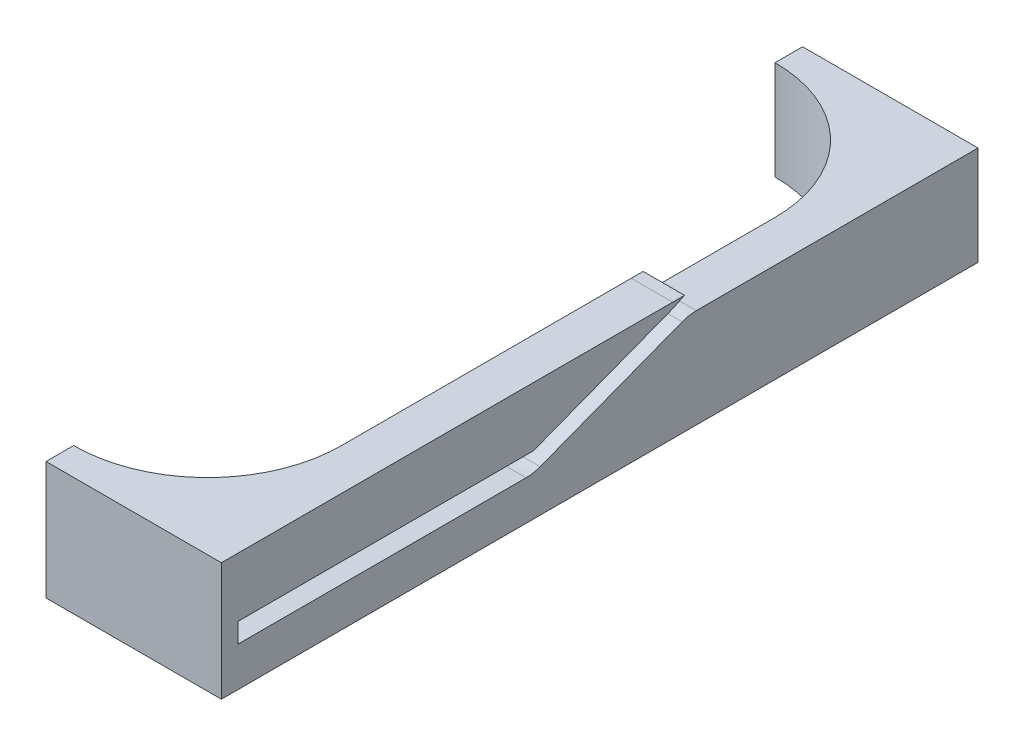
from build123d import *

# Parameters (mm, degrees)
SKETCH1_W           = 89
SKETCH1_H           = 192
BOSS_EXTRUDE1_DEPTH = 30
SKETCH2_R           = 34.99943994
CUT_EXTRUDE1_DEPTH  = 10
SKETCH3_W           = 75
SKETCH3_H           = 5
CUT_EXTRUDE2_DEPTH  = 102
CUT_EXTRUDE4_DEPTH  = 102
SKETCH6_W           = 10.5
SKETCH6_H           = 4
CUT_EXTRUDE7_DEPTH  = 8
BOSS_EXTRUDE2_DEPTH = 10.5
CUT_EXTRUDE8_DEPTH  = 20.767757578
BOSS_EXTRUDE3_DEPTH = 10.5
CUT_EXTRUDE9_DEPTH  = 22.812544275
BOSS_EXTRUDE6_DEPTH = 10.5
BOSS_EXTRUDE7_DEPTH = 10.5
FILLET1_R           = 10
FILLET2_R           = 10
FILLET3_R           = 10
FILLET4_R           = 10
CUT_EXTRUDE11_DEPTH = 99
SKETCH15_W          = 7.554212703
SKETCH15_H          = 3.259234926
CUT_EXTRUDE12_DEPTH = 99
FILLET5_R           = 10
SKETCH16_W          = 51.485854904
SKETCH16_H          = 41.780762453
CUT_EXTRUDE13_DEPTH = 221


with BuildPart() as part:
    # Sketch1 → Boss-Extrude1 (new body)
    with BuildSketch(Plane(origin=(0, 0, 0), x_dir=(1, 0, 0), z_dir=(0, 1, 0))):
        with Locations((-10.5, 20.043668932)):
            Rectangle(SKETCH1_W, SKETCH1_H)
        with BuildLine():
            Line((-44.5, -34.956331068), (-44.5, 75.043668932))
            ThreePointArc((-44.5, 75.043668932), (-10.5, 109.043668932), (23.5, 75.043668932))
            Line((23.5, 75.043668932), (23.5, -34.956331068))
            ThreePointArc((23.5, -34.956331068), (-10.5, -68.956331068), (-44.5, -34.956331068))
        make_face(mode=Mode.SUBTRACT)
    extrude(amount=BOSS_EXTRUDE1_DEPTH)

    # Sketch2 → Cut-Extrude1 (cut)
    with BuildSketch(Plane.XZ):
        with Locations((-10.5, 37.838844027)):
            Circle(SKETCH2_R)
    extrude(amount=-CUT_EXTRUDE1_DEPTH, mode=Mode.SUBTRACT)

    # Sketch3 → Cut-Extrude2 (cut)
    with BuildSketch(Plane(origin=(34, 0, 0), x_dir=(0, 0, -1), z_dir=(1, 0, 0))):
        with Locations((-34.286288065, 12.5)):
            Rectangle(SKETCH3_W, SKETCH3_H)
    extrude(amount=-CUT_EXTRUDE2_DEPTH, mode=Mode.SUBTRACT)

    # Sketch4 → Cut-Extrude4 (cut)
    with BuildSketch(Plane.ZY.offset(55)):
        Polygon((-40.970715348, 29.469395922), (-41.211628541, 24.561719678), (-3.213711935, 10), (-3.213711935, 15), align=None)
    extrude(amount=-CUT_EXTRUDE4_DEPTH, mode=Mode.SUBTRACT)

    # Sketch6 → Cut-Extrude7 (cut)
    with BuildSketch(Plane(origin=(0, 30, 0), x_dir=(1, 0, 0), z_dir=(0, 1, 0))):
        with Locations((-49.75, 40.570603007)):
            Rectangle(SKETCH6_W, SKETCH6_H)
        with Locations((28.75, 40.570603007)):
            Rectangle(SKETCH6_W, SKETCH6_H)
    extrude(amount=-CUT_EXTRUDE7_DEPTH, mode=Mode.SUBTRACT)

    # Sketch7 → Boss-Extrude2 (add)
    with BuildSketch(Plane.ZY.offset(55)):
        Polygon((-38.570603007, 23.549614886), (-42.570603007, 25.082511526), (-42.570603007, 22), (-38.570603007, 22), align=None)
    extrude(amount=-BOSS_EXTRUDE2_DEPTH)

    # Sketch8 → Cut-Extrude8 (cut)
    with BuildSketch(Plane.ZY.offset(55)):
        Polygon((-42.570603007, 25.082511526), (-55.402488324, 30), (-42.570603007, 30), align=None)
    extrude(amount=-CUT_EXTRUDE8_DEPTH, mode=Mode.SUBTRACT)

    # Sketch9 → Boss-Extrude3 (add)
    with BuildSketch(Plane(origin=(34, 0, 0), x_dir=(0, 0, -1), z_dir=(1, 0, 0))):
        Polygon((38.570603007, 23.549614886), (42.570603007, 25.082511526), (42.570603007, 22), (38.570603007, 22), align=None)
    extrude(amount=-BOSS_EXTRUDE3_DEPTH)

    # Sketch10 → Cut-Extrude9 (cut)
    with BuildSketch(Plane(origin=(34, 0, 0), x_dir=(0, 0, -1), z_dir=(1, 0, 0))):
        Polygon((42.570603007, 25.082511526), (55.402488324, 30), (42.570603007, 30), align=None)
    extrude(amount=-CUT_EXTRUDE9_DEPTH, mode=Mode.SUBTRACT)

    # Sketch12 → Boss-Extrude6 (add)
    with BuildSketch(Plane.ZY.offset(55)):
        Polygon((-38.570603007, 30), (-41.570603007, 30), (-38.570603007, 28.549614886), align=None)
    extrude(amount=-BOSS_EXTRUDE6_DEPTH)

    # Sketch11 → Boss-Extrude7 (add)
    with BuildSketch(Plane(origin=(34, 0, 0), x_dir=(0, 0, -1), z_dir=(1, 0, 0))):
        Polygon((38.570603007, 28.549614886), (41.570603007, 30.007074027), (38.570603007, 30), align=None)
    extrude(amount=-BOSS_EXTRUDE7_DEPTH)

    # Fillet1
    fillet1_edges = [part.edges().sort_by_distance(p)[0] for p in [
        (-49.75, 30, -55.402488324),
    ]]
    fillet(fillet1_edges, radius=FILLET1_R)

    # Fillet2
    fillet2_edges = [part.edges().sort_by_distance(p)[0] for p in [
        (28.75, 30, -55.402488324),
    ]]
    fillet(fillet2_edges, radius=FILLET2_R)

    # Fillet3
    fillet3_edges = [part.edges().sort_by_distance(p)[0] for p in [
        (-49.75, 10, -3.213711935),
    ]]
    fillet(fillet3_edges, radius=FILLET3_R)

    # Fillet4
    fillet4_edges = [part.edges().sort_by_distance(p)[0] for p in [
        (28.75, 10, -3.213711935),
    ]]
    fillet(fillet4_edges, radius=FILLET4_R)

    # Sketch14 → Cut-Extrude11 (cut)
    with BuildSketch(Plane(origin=(34, 0, 0), x_dir=(0, 0, -1), z_dir=(1, 0, 0))):
        Polygon((42.717415751, 25.138773717), (116.043668932, 25.138773717), (116.043668932, 30), (57.252994033, 30), (53.674522762, 29.337801849), align=None)
    extrude(amount=-CUT_EXTRUDE11_DEPTH, mode=Mode.SUBTRACT)


with BuildPart() as cut_extrude11_piece_1:
    # of the separate pieces the step leaves, piece 1, a body of its own (cut_extrude11_pieces)
    add(part.part.solids().sort_by_distance((23.5, 25.138773717, -42.717415751))[0])

    # Fillet5
    fillet5_edges = [cut_extrude11_piece_1.edges().sort_by_distance(p)[0] for p in [
        (-49.75, 25.138773717, -42.717415751),
        (28.75, 25.138773717, -42.717415751),
    ]]
    fillet(fillet5_edges, radius=FILLET5_R)

    # Sketch16 → Cut-Extrude13 (cut)
    with BuildSketch(Plane(origin=(0, 0, -116.043668932), x_dir=(-1, 0, 0), z_dir=(0, 0, -1))):
        with Locations((36.242927452, 18.346859621)):
            Rectangle(SKETCH16_W, SKETCH16_H)
    extrude(amount=-CUT_EXTRUDE13_DEPTH, mode=Mode.SUBTRACT)


with BuildPart() as cut_extrude11_piece_2:
    # of the separate pieces the step leaves, piece 2, a body of its own (cut_extrude11_pieces)
    add(part.part.solids().sort_by_distance((23.5, 30, -57.252994033))[0])


with BuildPart() as cut_extrude11_piece_3:
    # of the separate pieces the step leaves, piece 3, a body of its own (cut_extrude11_pieces)
    add(part.part.solids().sort_by_distance((-55, 30, -57.252994033))[0])


with BuildPart() as cut_extrude12_tool:
    # Sketch15 → Cut-Extrude12 (new body)
    with BuildSketch(Plane(origin=(34, 0, 0), x_dir=(0, 0, -1), z_dir=(1, 0, 0))):
        with Locations((54.846987071, 29.864387296)):
            Rectangle(SKETCH15_W, SKETCH15_H)
    extrude(amount=-CUT_EXTRUDE12_DEPTH)


with BuildPart() as cut_extrude11_piece_2_1:
    add(cut_extrude11_piece_2.part)

    # Cut-Extrude12: cut by cut_extrude12_tool
    add(cut_extrude12_tool.part, mode=Mode.SUBTRACT)


with BuildPart() as cut_extrude11_piece_3_1:
    add(cut_extrude11_piece_3.part)

    # Cut-Extrude12: cut by cut_extrude12_tool
    add(cut_extrude12_tool.part, mode=Mode.SUBTRACT)


solid = cut_extrude11_piece_1.part
